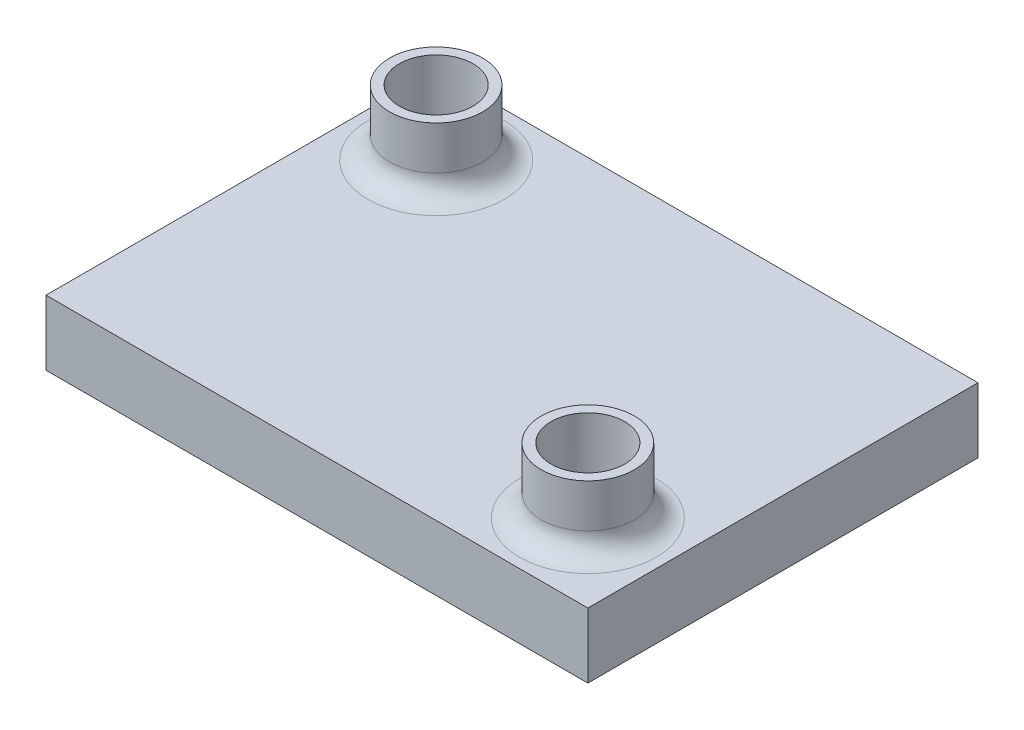
from build123d import *

# Parameters (mm, degrees)
SKETCH2_W           = 25
SKETCH2_H           = 18
BOSS_EXTRUDE1_DEPTH = 3
SKETCH3_R           = 1.7
CUT_EXTRUDE1_DEPTH  = 16.692354826
BOSS_EXTRUDE2_START = 3
SKETCH4_R           = 2.15
SKETCH4_R_2         = 1.7
BOSS_EXTRUDE2_DEPTH = 3
FILLET1_R           = 1
CUT_EXTRUDE2_DEPTH  = 2


with BuildPart() as part:
    # Sketch2 → Boss-Extrude1 (new body)
    with BuildSketch(Plane(origin=(0, 0, 0), x_dir=(1, 0, 0), z_dir=(0, 1, 0))):
        Rectangle(SKETCH2_W, SKETCH2_H)
    extrude(amount=BOSS_EXTRUDE1_DEPTH)

    # Sketch3 → Cut-Extrude1 (cut, through all)
    with BuildSketch(Plane(origin=(0, 3, 0), x_dir=(1, 0, 0), z_dir=(0, 1, 0))):
        with Locations(Location((-8.899893258, 5.4, 0), (0, 0, 270))):
            Circle(SKETCH3_R)
        with Locations(Location((8.899893258, -5.4, 0), (0, 0, 270))):
            Circle(SKETCH3_R)
    extrude(amount=-CUT_EXTRUDE1_DEPTH, mode=Mode.SUBTRACT)

    # Sketch4 → Boss-Extrude2 (add)
    # profile 1 of 2: a face of its own
    with BuildSketch(Plane(origin=(0, 3, 0), x_dir=(1, 0, 0), z_dir=(0, 1, 0)).offset(BOSS_EXTRUDE2_START)):
        with Locations(Location((-8.899893258, 5.4, 0), (0, 0, 270))):
            Circle(SKETCH4_R)
        with Locations(Location((-8.899893258, 5.4, 0), (0, 0, 270))):
            Circle(SKETCH4_R_2, mode=Mode.SUBTRACT)
    # profile 2 of 2: a face of its own
    with BuildSketch(Plane(origin=(0, 3, 0), x_dir=(1, 0, 0), z_dir=(0, 1, 0)).offset(BOSS_EXTRUDE2_START)):
        with Locations(Location((8.899893258, -5.4, 0), (0, 0, 270))):
            Circle(SKETCH4_R)
        with Locations(Location((8.899893258, -5.4, 0), (0, 0, 270))):
            Circle(SKETCH4_R_2, mode=Mode.SUBTRACT)
    extrude(amount=-BOSS_EXTRUDE2_DEPTH)

    # Fillet1
    fillet1_edges = [part.edges().sort_by_distance(p)[0] for p in [
        (-8.899893258, 3, -7.55),
        (8.899893258, 3, 3.25),
    ]]
    fillet(fillet1_edges, radius=FILLET1_R)

    # Sketch5 → Cut-Extrude2 (cut)
    with BuildSketch(Plane.XZ):
        Polygon((10.545341525, 2.55), (12.190789792, 5.4), (10.545341525, 8.25), (7.254444991, 8.25), (5.608996723, 5.4), (7.254444991, 2.55), align=None)
        Polygon((-7.254444991, -8.25), (-5.608996723, -5.4), (-7.254444991, -2.55), (-10.545341525, -2.55), (-12.190789792, -5.4), (-10.545341525, -8.25), align=None)
    extrude(amount=-CUT_EXTRUDE2_DEPTH, mode=Mode.SUBTRACT)


solid = part.part
